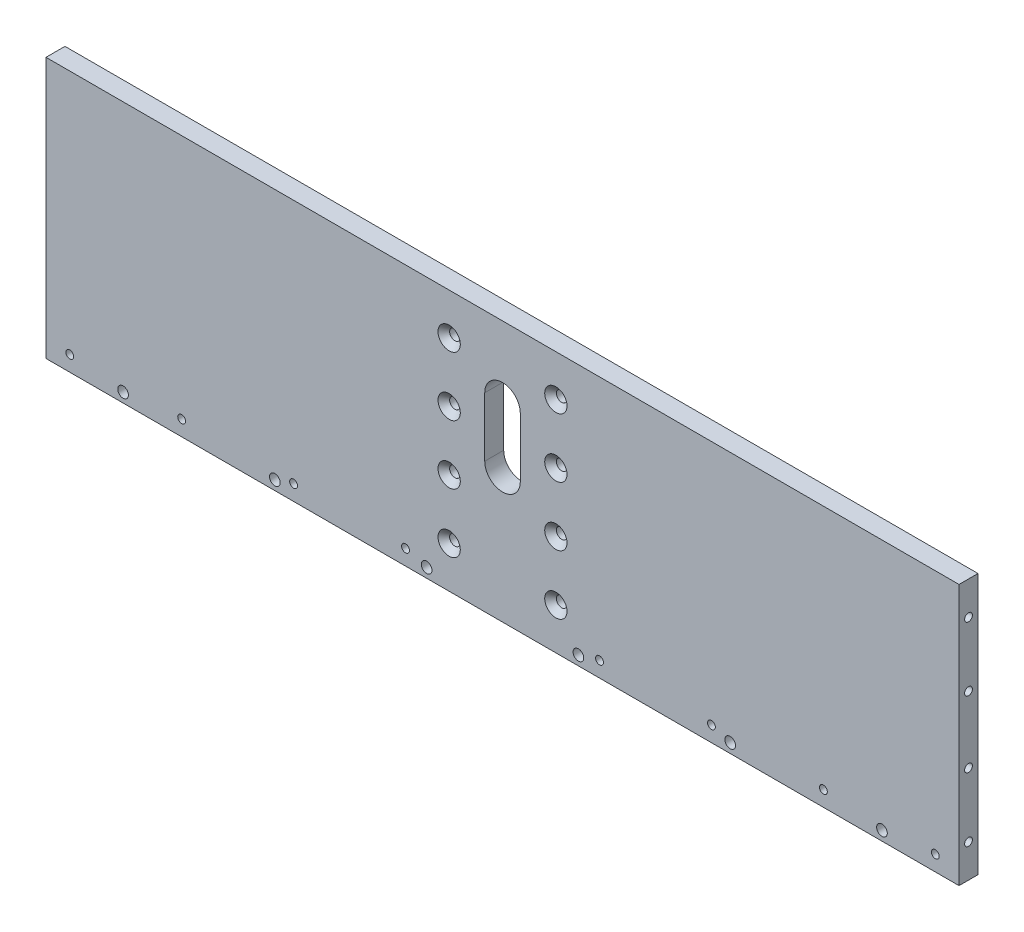
from build123d import *

# Parameters (mm, degrees)
SKETCH1_W                                       = 385
SKETCH1_H                                       = 110
EXTRUDE1_DEPTH                                  = 8
SKETCH2_R                                       = 2
CUT_EXTRUDE1_DEPTH                              = 10
CSK_FOR_M4_FLAT_HEAD_MACHINE_SCREW1_D           = 4.5
CSK_FOR_M4_FLAT_HEAD_MACHINE_SCREW1_CSINK_D     = 9.4
CSK_FOR_M4_FLAT_HEAD_MACHINE_SCREW1_CSINK_ANGLE = 90
SKETCH5_R                                       = 1.65
CUT_EXTRUDE2_DEPTH                              = 15
SKETCH6_R                                       = 2.25
CUT_EXTRUDE3_DEPTH                              = 10
CUT_EXTRUDE4_DEPTH                              = 6
CUT_EXTRUDE5_DEPTH                              = 10
CSK_FOR_M4_FLAT_HEAD_MACHINE_SCREW2_D           = 4.5
CSK_FOR_M4_FLAT_HEAD_MACHINE_SCREW2_CSINK_D     = 9.4
CSK_FOR_M4_FLAT_HEAD_MACHINE_SCREW2_CSINK_ANGLE = 90
SKETCH14_R                                      = 1.65
CUT_EXTRUDE6_DEPTH                              = 10


with BuildPart() as part:
    # Sketch1 → Extrude1 (new body)
    with BuildSketch(Plane.XY):
        Rectangle(SKETCH1_W, SKETCH1_H)
    extrude(amount=EXTRUDE1_DEPTH)

    # Sketch2 → Cut-Extrude1 (cut)
    with BuildSketch(Plane.XY.offset(8)):
        with Locations((22.5, 37.5)):
            Circle(SKETCH2_R)
        with Locations((22.5, 12.5)):
            Circle(SKETCH2_R)
        with Locations(Location((22.5, -12.5, 0), (0, 0, 180))):
            Circle(SKETCH2_R)
        with Locations((-22.5, -12.5)):
            Circle(SKETCH2_R)
        with Locations((-22.5, -37.5)):
            Circle(SKETCH2_R)
        with Locations(Location((22.5, -37.5, 0), (0, 0, 180))):
            Circle(SKETCH2_R)
        with Locations(Location((-22.5, 12.5, 0), (0, 0, 180))):
            Circle(SKETCH2_R)
        with Locations(Location((-22.5, 37.5, 0), (0, 0, 180))):
            Circle(SKETCH2_R)
    extrude(amount=-CUT_EXTRUDE1_DEPTH, mode=Mode.SUBTRACT)

    # CSK for M4 Flat Head Machine Screw1 (through all)
    with Locations(Plane.XY.offset(8)):
        with Locations((22.5, 37.5), (22.5, 12.5), (-22.5, 12.5), (-22.5, 37.5), (-22.5, -12.5), (22.5, -12.5), (22.5, -37.5), (-22.5, -37.5)):
            CounterSinkHole(CSK_FOR_M4_FLAT_HEAD_MACHINE_SCREW1_D / 2, CSK_FOR_M4_FLAT_HEAD_MACHINE_SCREW1_CSINK_D / 2, counter_sink_angle=CSK_FOR_M4_FLAT_HEAD_MACHINE_SCREW1_CSINK_ANGLE)

    # Sketch5 → Cut-Extrude2 (cut)
    with BuildSketch(Plane(origin=(192.5, 0, 0), x_dir=(0, 0, -1), z_dir=(1, 0, 0))):
        with Locations((-4, 41)):
            Circle(SKETCH5_R)
        with Locations((-4, 14)):
            Circle(SKETCH5_R)
        with Locations(Location((-4, -41, 0), (0, 0, 180))):
            Circle(SKETCH5_R)
        with Locations(Location((-4, -14, 0), (0, 0, 180))):
            Circle(SKETCH5_R)
    cut_extrude2 = extrude(amount=-CUT_EXTRUDE2_DEPTH, mode=Mode.SUBTRACT)

    # Mirror1: Cut-Extrude2 across plane
    add(cut_extrude2.mirror(Plane(origin=(0, 0, 0), x_dir=(0, 0, 1), z_dir=(1, 0, 0))), mode=Mode.SUBTRACT)

    # Sketch6 → Cut-Extrude3 (cut)
    with BuildSketch(Plane(origin=(0, 0, 0), x_dir=(-1, 0, 0), z_dir=(0, 0, -1))):
        with Locations((-96, -51)):
            Circle(SKETCH6_R)
        with Locations((-32, -51)):
            Circle(SKETCH6_R)
        with Locations((32, -51)):
            Circle(SKETCH6_R)
        with Locations((96, -51)):
            Circle(SKETCH6_R)
        with Locations((-160, -51)):
            Circle(SKETCH6_R)
        with Locations((160, -51)):
            Circle(SKETCH6_R)
    extrude(amount=-CUT_EXTRUDE3_DEPTH, mode=Mode.SUBTRACT)

    # Sketch9 → Cut-Extrude4 (cut)
    with BuildSketch(Plane(origin=(0, 0, 0), x_dir=(-1, 0, 0), z_dir=(0, 0, -1))):
        with BuildLine():
            Line((-162.5, 40), (-162.5, -40))
            ThreePointArc((-162.5, -40), (-167.5, -45), (-172.5, -40))
            Line((-172.5, -40), (-172.5, 40))
            ThreePointArc((-172.5, 40), (-167.5, 45), (-162.5, 40))
        make_face()
        with BuildLine():
            Line((-149.5, 40), (-149.5, -40))
            ThreePointArc((-149.5, -40), (-154.5, -45), (-159.5, -40))
            Line((-159.5, -40), (-159.5, 40))
            ThreePointArc((-159.5, 40), (-154.5, 45), (-149.5, 40))
        make_face()
        with BuildLine():
            Line((-136.5, 40), (-136.5, -40))
            ThreePointArc((-136.5, -40), (-141.5, -45), (-146.5, -40))
            Line((-146.5, -40), (-146.5, 40))
            ThreePointArc((-146.5, 40), (-141.5, 45), (-136.5, 40))
        make_face()
        with BuildLine():
            Line((-123.5, 40), (-123.5, -40))
            ThreePointArc((-123.5, -40), (-128.5, -45), (-133.5, -40))
            Line((-133.5, -40), (-133.5, 40))
            ThreePointArc((-133.5, 40), (-128.5, 45), (-123.5, 40))
        make_face()
        with BuildLine():
            Line((-110.5, 40), (-110.5, -40))
            ThreePointArc((-110.5, -40), (-115.5, -45), (-120.5, -40))
            Line((-120.5, -40), (-120.5, 40))
            ThreePointArc((-120.5, 40), (-115.5, 45), (-110.5, 40))
        make_face()
        with BuildLine():
            Line((-97.5, 40), (-97.5, -40))
            ThreePointArc((-97.5, -40), (-102.5, -45), (-107.5, -40))
            Line((-107.5, -40), (-107.5, 40))
            ThreePointArc((-107.5, 40), (-102.5, 45), (-97.5, 40))
        make_face()
        with BuildLine():
            Line((-84.5, 40), (-84.5, -40))
            ThreePointArc((-84.5, -40), (-89.5, -45), (-94.5, -40))
            Line((-94.5, -40), (-94.5, 40))
            ThreePointArc((-94.5, 40), (-89.5, 45), (-84.5, 40))
        make_face()
        with BuildLine():
            Line((-71.5, 40), (-71.5, -40))
            ThreePointArc((-71.5, -40), (-76.5, -45), (-81.5, -40))
            Line((-81.5, -40), (-81.5, 40))
            ThreePointArc((-81.5, 40), (-76.5, 45), (-71.5, 40))
        make_face()
        with BuildLine():
            Line((-58.5, 40), (-58.5, -40))
            ThreePointArc((-58.5, -40), (-63.5, -45), (-68.5, -40))
            Line((-68.5, -40), (-68.5, 40))
            ThreePointArc((-68.5, 40), (-63.5, 45), (-58.5, 40))
        make_face()
        with BuildLine():
            Line((-45.5, 40), (-45.5, -40))
            ThreePointArc((-45.5, -40), (-50.5, -45), (-55.5, -40))
            Line((-55.5, -40), (-55.5, 40))
            ThreePointArc((-55.5, 40), (-50.5, 45), (-45.5, 40))
        make_face()
        with BuildLine():
            Line((-32.5, 40), (-32.5, -40))
            ThreePointArc((-32.5, -40), (-37.5, -45), (-42.5, -40))
            Line((-42.5, -40), (-42.5, 40))
            ThreePointArc((-42.5, 40), (-37.5, 45), (-32.5, 40))
        make_face()
        with BuildLine():
            Line((162.5, 40), (162.5, -40))
            ThreePointArc((162.5, -40), (167.5, -45), (172.5, -40))
            Line((172.5, -40), (172.5, 40))
            ThreePointArc((172.5, 40), (167.5, 45), (162.5, 40))
        make_face()
        with BuildLine():
            Line((149.5, 40), (149.5, -40))
            ThreePointArc((149.5, -40), (154.5, -45), (159.5, -40))
            Line((159.5, -40), (159.5, 40))
            ThreePointArc((159.5, 40), (154.5, 45), (149.5, 40))
        make_face()
        with BuildLine():
            Line((136.5, 40), (136.5, -40))
            ThreePointArc((136.5, -40), (141.5, -45), (146.5, -40))
            Line((146.5, -40), (146.5, 40))
            ThreePointArc((146.5, 40), (141.5, 45), (136.5, 40))
        make_face()
        with BuildLine():
            Line((123.5, 40), (123.5, -40))
            ThreePointArc((123.5, -40), (128.5, -45), (133.5, -40))
            Line((133.5, -40), (133.5, 40))
            ThreePointArc((133.5, 40), (128.5, 45), (123.5, 40))
        make_face()
        with BuildLine():
            Line((110.5, 40), (110.5, -40))
            ThreePointArc((110.5, -40), (115.5, -45), (120.5, -40))
            Line((120.5, -40), (120.5, 40))
            ThreePointArc((120.5, 40), (115.5, 45), (110.5, 40))
        make_face()
        with BuildLine():
            Line((97.5, 40), (97.5, -40))
            ThreePointArc((97.5, -40), (102.5, -45), (107.5, -40))
            Line((107.5, -40), (107.5, 40))
            ThreePointArc((107.5, 40), (102.5, 45), (97.5, 40))
        make_face()
        with BuildLine():
            Line((84.5, 40), (84.5, -40))
            ThreePointArc((84.5, -40), (89.5, -45), (94.5, -40))
            Line((94.5, -40), (94.5, 40))
            ThreePointArc((94.5, 40), (89.5, 45), (84.5, 40))
        make_face()
        with BuildLine():
            Line((71.5, 40), (71.5, -40))
            ThreePointArc((71.5, -40), (76.5, -45), (81.5, -40))
            Line((81.5, -40), (81.5, 40))
            ThreePointArc((81.5, 40), (76.5, 45), (71.5, 40))
        make_face()
        with BuildLine():
            Line((58.5, 40), (58.5, -40))
            ThreePointArc((58.5, -40), (63.5, -45), (68.5, -40))
            Line((68.5, -40), (68.5, 40))
            ThreePointArc((68.5, 40), (63.5, 45), (58.5, 40))
        make_face()
        with BuildLine():
            Line((45.5, 40), (45.5, -40))
            ThreePointArc((45.5, -40), (50.5, -45), (55.5, -40))
            Line((55.5, -40), (55.5, 40))
            ThreePointArc((55.5, 40), (50.5, 45), (45.5, 40))
        make_face()
        with BuildLine():
            Line((32.5, 40), (32.5, -40))
            ThreePointArc((32.5, -40), (37.5, -45), (42.5, -40))
            Line((42.5, -40), (42.5, 40))
            ThreePointArc((42.5, 40), (37.5, 45), (32.5, 40))
        make_face()
    extrude(amount=-CUT_EXTRUDE4_DEPTH, mode=Mode.SUBTRACT)

    # Sketch10 → Cut-Extrude5 (cut)
    with BuildSketch(Plane.XY.offset(8)):
        with BuildLine():
            Line((-7.5, 0), (-7.5, 25))
            ThreePointArc((-7.5, 25), (0, 32.5), (7.5, 25))
            Line((7.5, 25), (7.5, 0))
            ThreePointArc((7.5, 0), (0, -7.5), (-7.5, 0))
        make_face()
    extrude(amount=-CUT_EXTRUDE5_DEPTH, mode=Mode.SUBTRACT)

    # CSK for M4 Flat Head Machine Screw2 (through all)
    with Locations(Plane(origin=(0, 0, 0), x_dir=(-1, 0, 0), z_dir=(0, 0, -1))):
        with Locations((-160, -51), (-96, -51), (-32, -51), (32, -51), (96, -51), (160, -51)):
            CounterSinkHole(CSK_FOR_M4_FLAT_HEAD_MACHINE_SCREW2_D / 2, CSK_FOR_M4_FLAT_HEAD_MACHINE_SCREW2_CSINK_D / 2, counter_sink_angle=CSK_FOR_M4_FLAT_HEAD_MACHINE_SCREW2_CSINK_ANGLE)

    # Sketch14 → Cut-Extrude6 (cut)
    with BuildSketch(Plane(origin=(0, 0, 0), x_dir=(-1, 0, 0), z_dir=(0, 0, -1))):
        with Locations((-182.5, -48.5)):
            Circle(SKETCH14_R)
        with Locations((-135.3, -48.5)):
            Circle(SKETCH14_R)
        with Locations((-88.1, -48.5)):
            Circle(SKETCH14_R)
        with Locations((-40.9, -48.5)):
            Circle(SKETCH14_R)
        with Locations((40.9, -48.5)):
            Circle(SKETCH14_R)
        with Locations((88.1, -48.5)):
            Circle(SKETCH14_R)
        with Locations((135.3, -48.5)):
            Circle(SKETCH14_R)
        with Locations((182.5, -48.5)):
            Circle(SKETCH14_R)
    extrude(amount=-CUT_EXTRUDE6_DEPTH, mode=Mode.SUBTRACT)


solid = part.part
